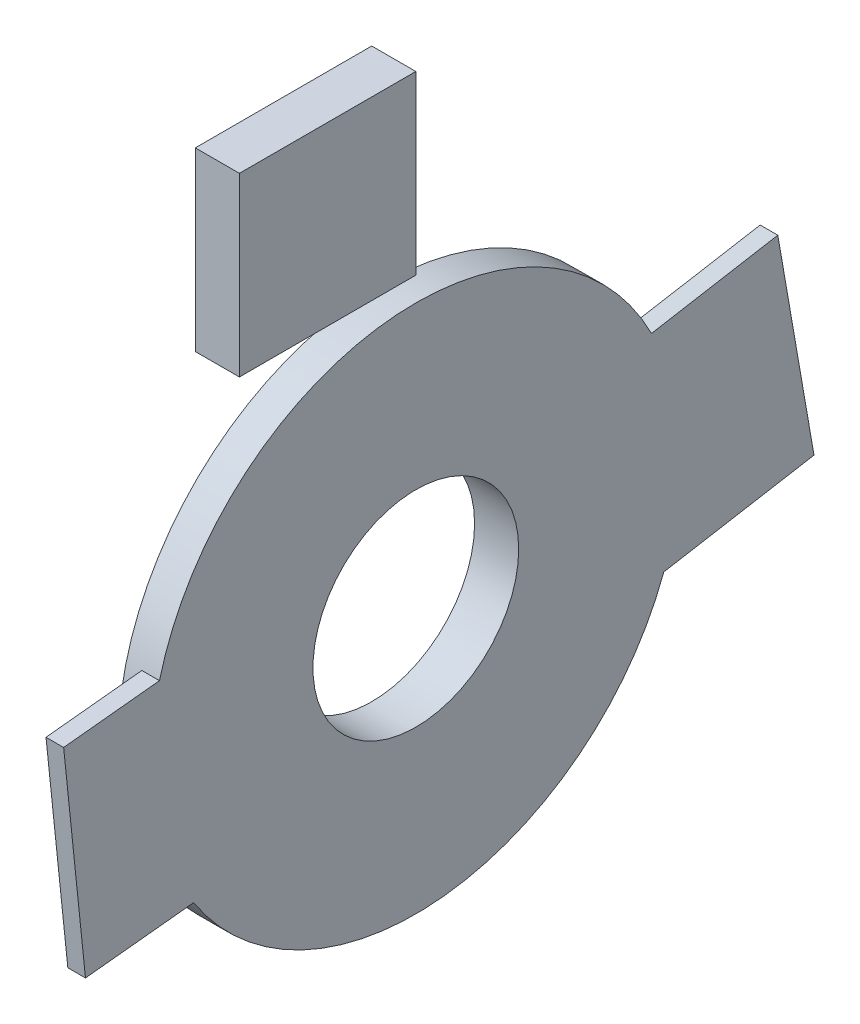
from build123d import *

# Parameters (mm, degrees)
SKETCH1_R           = 19.05
SKETCH1_R_2         = 7.405671903
BOSS_EXTRUDE1_DEPTH = 3.175
SKETCH3_W           = 0.7874
SKETCH3_H           = 9.525
SKETCH4_W           = 12.7
SKETCH4_H           = 12.7
BOSS_EXTRUDE2_DEPTH = 3.175
BOSS_EXTRUDE3_DEPTH = 1.27


with BuildPart() as part:
    # Sketch1 → Boss-Extrude1 (new body)
    with BuildSketch(Plane(origin=(0, 0, 0), x_dir=(0, 0, -1), z_dir=(1, 0, 0))):
        Circle(SKETCH1_R)
        Circle(SKETCH1_R_2, mode=Mode.SUBTRACT)
    extrude(amount=BOSS_EXTRUDE1_DEPTH)

    # Sketch3 → Cut-Revolve1 (revolve, cut)
    with BuildSketch(Plane.XY, mode=Mode.PRIVATE) as cut_revolve1_sk:
        with Locations((0.3937, 14.2875)):
            Rectangle(SKETCH3_W, SKETCH3_H)
    revolve(cut_revolve1_sk.sketch.rotate(Axis((0, 0, 0), (1, 0, 0)), 90), axis=Axis((0, 0, 0), (1, 0, 0)), mode=Mode.SUBTRACT)

    # Sketch5 → Boss-Extrude3 (add)
    with BuildSketch(Plane(origin=(3.175, 0, 0), x_dir=(0, 0, -1), z_dir=(1, 0, 0))):
        Polygon((12.603193196, 7.906953093), (15.207933879, -7.108802831), (28.663115508, -4.774770556), (26.058374826, 10.240985369), align=None)
        Polygon((-14.91337831, 5.091744809), (-13.341601287, -10.066985909), (-23.781025765, -11.149427957), (-25.352802787, 4.009302762), align=None)
    extrude(amount=-BOSS_EXTRUDE3_DEPTH)


with BuildPart() as body_2:
    # Sketch4 → Boss-Extrude2 (new body)
    with BuildSketch(Plane(origin=(3.175, 0, 0), x_dir=(0, 0, -1), z_dir=(1, 0, 0))):
        with Locations((-6.35, 27.126355703)):
            Rectangle(SKETCH4_W, SKETCH4_H)
    extrude(amount=-BOSS_EXTRUDE2_DEPTH)


solid = Compound([part.part, body_2.part])
